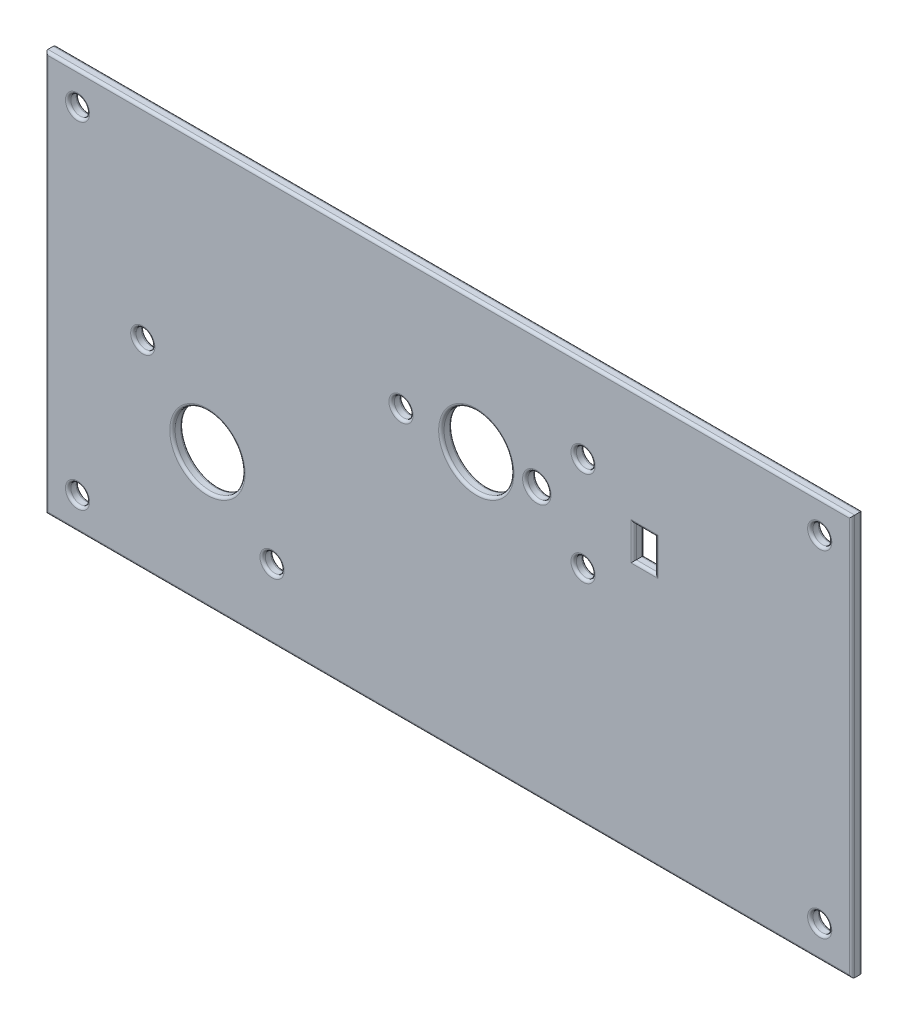
from build123d import *

# Parameters (mm, degrees)
SKETCH1_W           = 150
SKETCH1_H           = 74.5
SKETCH1_R           = 6.5
SKETCH1_R_2         = 1.75
SKETCH1_R_3         = 2.15
BOSS_EXTRUDE1_DEPTH = 2
FILLET1_R           = 0.5


with BuildPart() as part:
    # Sketch1 → Boss-Extrude1 (new body)
    with BuildSketch(Plane.XY):
        with Locations((75, 37.25)):
            Rectangle(SKETCH1_W, SKETCH1_H)
        with Locations((80.15, 50)):
            Circle(SKETCH1_R, mode=Mode.SUBTRACT)
        with Locations((66.15, 50)):
            Circle(SKETCH1_R_2, mode=Mode.SUBTRACT)
        with Locations((91.4, 50)):
            Circle(SKETCH1_R_3, mode=Mode.SUBTRACT)
        with Locations((100, 58.8)):
            Circle(SKETCH1_R_2, mode=Mode.SUBTRACT)
        with Locations((100, 41.2)):
            Circle(SKETCH1_R_2, mode=Mode.SUBTRACT)
        with Locations((6, 68.5)):
            Circle(SKETCH1_R_2, mode=Mode.SUBTRACT)
        with Locations((6, 6)):
            Circle(SKETCH1_R_2, mode=Mode.SUBTRACT)
        with Locations((18.12918472, 37.02081528)):
            Circle(SKETCH1_R_2, mode=Mode.SUBTRACT)
        with Locations((42.17081528, 12.97918472)):
            Circle(SKETCH1_R_2, mode=Mode.SUBTRACT)
        with Locations((30.15, 25)):
            Circle(SKETCH1_R, mode=Mode.SUBTRACT)
        with Locations((144, 68.5)):
            Circle(SKETCH1_R_2, mode=Mode.SUBTRACT)
        with Locations((144, 6)):
            Circle(SKETCH1_R_2, mode=Mode.SUBTRACT)
        Polygon((109.4, 50), (109.4, 47), (113.4, 47), (113.4, 53), (109.4, 53), align=None, mode=Mode.SUBTRACT)
    extrude(amount=BOSS_EXTRUDE1_DEPTH)

    # Fillet1
    fillet1_edges = [part.edges().sort_by_distance(p)[0] for p in [
        (75, 0, 2),
        (150, 37.25, 2),
        (75, 74.5, 2),
        (0, 37.25, 2),
        (16.37918472, 37.02081528, 2),
        (40.42081528, 12.97918472, 2),
        (0, 37.25, 0),
        (75, 74.5, 0),
        (150, 37.25, 0),
        (75, 0, 0),
        (98.25, 58.8, 0),
        (4.25, 68.5, 0),
        (4.25, 6, 0),
        (23.65, 25, 0),
        (142.25, 68.5, 0),
        (98.25, 41.2, 2),
        (142.25, 6, 0),
        (113.4, 50, 0),
        (111.4, 53, 0),
        (109.4, 50, 0),
        (111.4, 47, 0),
        (73.65, 50, 0),
        (64.4, 50, 0),
        (89.25, 50, 0),
        (98.25, 41.2, 0),
        (40.42081528, 12.97918472, 0),
        (89.25, 50, 2),
        (16.37918472, 37.02081528, 0),
        (64.4, 50, 2),
        (73.65, 50, 2),
        (111.4, 47, 2),
        (109.4, 50, 2),
        (111.4, 53, 2),
        (113.4, 50, 2),
        (142.25, 6, 2),
        (142.25, 68.5, 2),
        (23.65, 25, 2),
        (4.25, 6, 2),
        (4.25, 68.5, 2),
        (98.25, 58.8, 2),
    ]]
    fillet(fillet1_edges, radius=FILLET1_R)


solid = part.part
